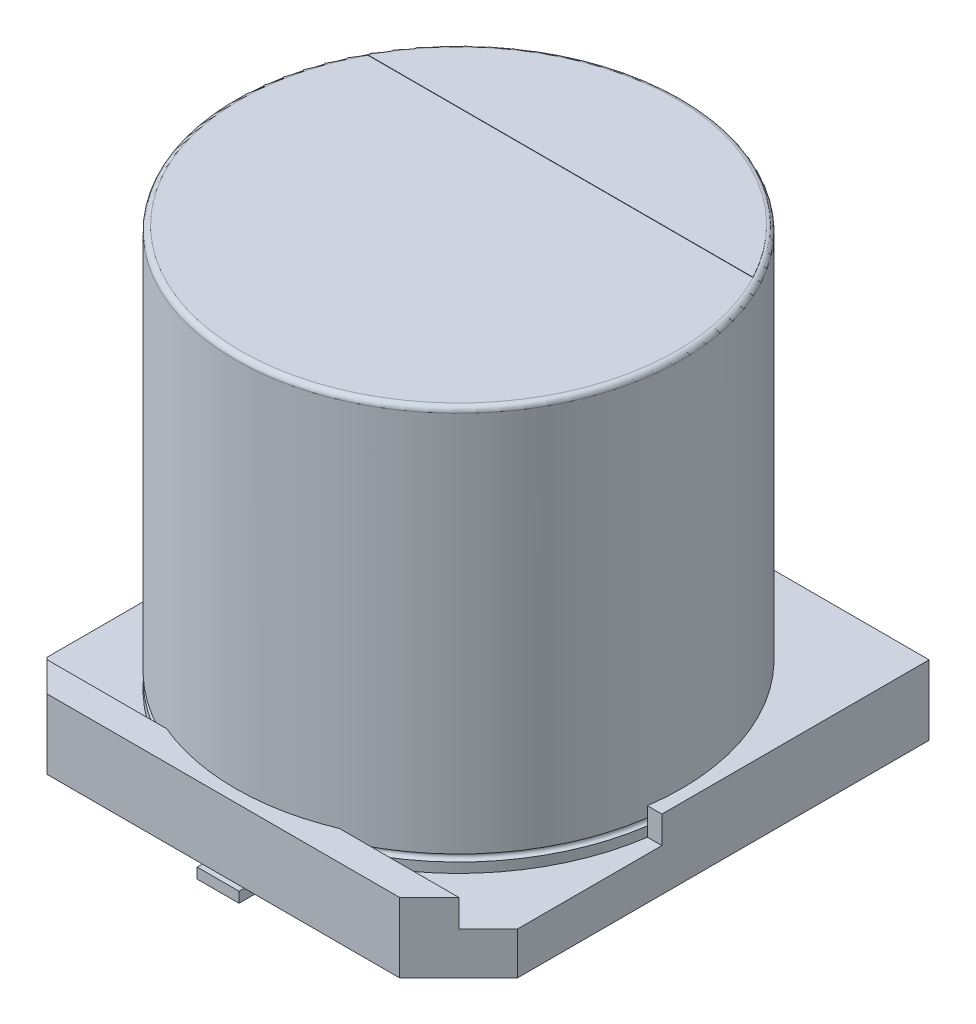
from build123d import *

# Parameters (mm, degrees)
BOSS_EXTRUDE1_DEPTH = 2
SKETCH2_R           = 6.4
CUT_EXTRUDE1_DEPTH  = 1
CUT_EXTRUDE4_REACH  = 17.225
SKETCH8_W           = 4.983499023
SKETCH8_H           = 1.601104922
BOSS_EXTRUDE4_DEPTH = 0.01
SKETCH9_W           = 1.2
SKETCH9_H           = 4.7
BOSS_EXTRUDE5_DEPTH = 0.3


with BuildPart() as part:
    # Sketch1 → Boss-Extrude1 (new body)
    with BuildSketch(Plane(origin=(0, 0, 0), x_dir=(1, 0, 0), z_dir=(0, 1, 0))):
        Polygon((-6.75, 6.75), (6.75, 6.75), (6.75, -5.061772225), (5.061772225, -6.75), (-5.061772225, -6.75), (-6.75, -5.061772225), align=None)
    extrude(amount=BOSS_EXTRUDE1_DEPTH)

    # Sketch2 → Cut-Extrude1 (cut)
    with BuildSketch(Plane(origin=(0, 2, 0), x_dir=(1, 0, 0), z_dir=(0, 1, 0))):
        with Locations(Location((0, 0, 0), (0, 0, 270))):
            Circle(SKETCH2_R)
    extrude(amount=-CUT_EXTRUDE1_DEPTH, mode=Mode.SUBTRACT)

    # Cut-Extrude4: up to this face of the body (flat: up to its plane)
    cut_extrude4_end = Plane(part.part.faces().sort_by_distance((6.75, 1, -0.844113887))[0])
    # Sketch8 → Cut-Extrude4 (cut, up to the picked face)
    with BuildSketch(Plane.ZY.offset(6.75), mode=Mode.PRIVATE) as cut_extrude4_sk1:
        with Locations((3.408264651, 2.017914887)):
            Rectangle(SKETCH8_W, SKETCH8_H)
    cut_extrude4_tool1 = split(extrude(cut_extrude4_sk1.sketch, amount=-CUT_EXTRUDE4_REACH, mode=Mode.PRIVATE), bisect_by=cut_extrude4_end, keep=Keep.BOTH, mode=Mode.PRIVATE)
    add(cut_extrude4_tool1.solids().sort_by(Axis((-6.75, 2.017915, 3.408265), (1, 0, 0)))[0], mode=Mode.SUBTRACT)

    # Sketch5 → Revolve1 (revolve)
    with BuildSketch(Plane.XY, mode=Mode.PRIVATE) as revolve1_sk:
        with BuildLine():
            Line((0, 0), (-6.4, 0))
            Line((-6.4, 0), (-6.4, 1.5))
            ThreePointArc((-6.4, 1.5), (-6.3, 1.6), (-6.4, 1.7))
            Line((-6.4, 1.7), (-6.4, 12.65))
            ThreePointArc((-6.4, 12.65), (-6.356066017, 12.756066017), (-6.25, 12.8))
            Line((-6.25, 12.8), (0, 12.8))
            Line((0, 12.8), (0, 0))
        make_face()
    revolve(revolve1_sk.sketch.rotate(Axis((0, 12.8, 0), (0, -1, 0)), 270), axis=Axis((0, 12.8, 0), (0, -1, 0)))

    # Sketch6 → Boss-Extrude4 (add)
    with BuildSketch(Plane(origin=(0, 12.8, 0), x_dir=(1, 0, 0), z_dir=(0, 1, 0))):
        with BuildLine():
            Line((-5.525359589, 2.921113044), (5.525359589, 2.921113044))
            ThreePointArc((5.525359589, 2.921113044), (0, 6.25), (-5.525359589, 2.921113044))
        make_face()
    extrude(amount=BOSS_EXTRUDE4_DEPTH)

    # Sketch9 → Boss-Extrude5 (add)
    with BuildSketch(Plane.XZ):
        with Locations((0, -4.55)):
            Rectangle(SKETCH9_W, SKETCH9_H)
        with Locations((0, 4.55)):
            Rectangle(SKETCH9_W, SKETCH9_H)
    extrude(amount=BOSS_EXTRUDE5_DEPTH)


solid = part.part
